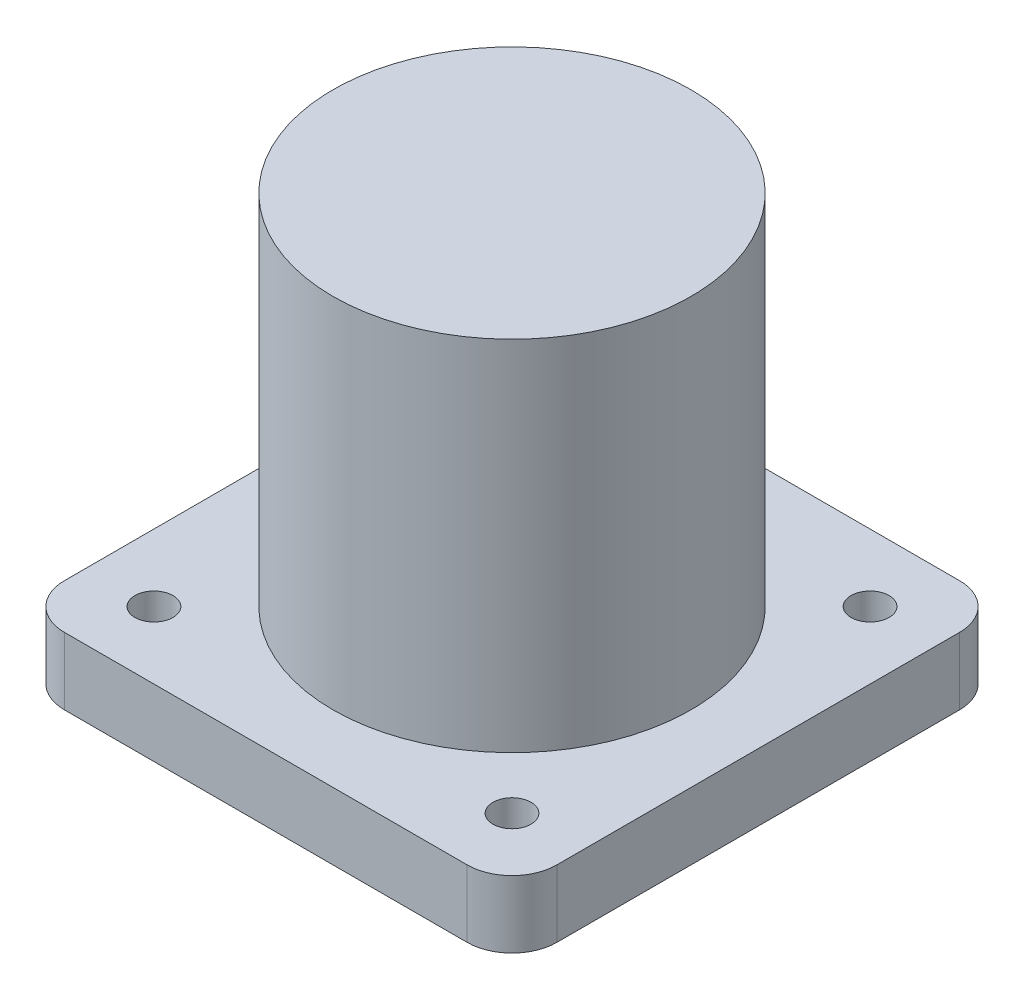
from build123d import *

# Parameters (mm, degrees)
SKETCH1_W           = 110
SKETCH1_H           = 110
BOSS_EXTRUDE1_DEPTH = 15
SKETCH3_R           = 4.25
CUT_EXTRUDE1_DEPTH  = 15
FILLET1_R           = 10
SKETCH4_R           = 40
BOSS_EXTRUDE2_DEPTH = 80


with BuildPart() as part:
    # Sketch1 → Boss-Extrude1 (new body)
    with BuildSketch(Plane(origin=(0, 0, 0), x_dir=(1, 0, 0), z_dir=(0, 1, 0))):
        with Locations((11.233421751, -25.384615385)):
            Rectangle(SKETCH1_W, SKETCH1_H)
    extrude(amount=BOSS_EXTRUDE1_DEPTH)

    # Sketch3 → Cut-Extrude1 (cut)
    with BuildSketch(Plane(origin=(0, 0, 0), x_dir=(-1, 0, 0), z_dir=(0, -1, 0))):
        with Locations(Location((28.766578249, -65.384615385, 0), (0, 0, 90))):
            Circle(SKETCH3_R)
        with Locations(Location((-51.233421751, -65.384615385, 0), (0, 0, 90))):
            Circle(SKETCH3_R)
        with Locations(Location((-51.233421751, 14.615384615, 0), (0, 0, 90))):
            Circle(SKETCH3_R)
        with Locations(Location((28.766578249, 14.615384615, 0), (0, 0, 90))):
            Circle(SKETCH3_R)
    extrude(amount=-CUT_EXTRUDE1_DEPTH, mode=Mode.SUBTRACT)

    # Fillet1
    fillet1_edges = [part.edges().sort_by_distance(p)[0] for p in [
        (-43.766578249, 7.5, -29.615384615),
        (66.233421751, 7.5, -29.615384615),
        (66.233421751, 7.5, 80.384615385),
        (-43.766578249, 7.5, 80.384615385),
    ]]
    fillet(fillet1_edges, radius=FILLET1_R)

    # Sketch4 → Boss-Extrude2 (add)
    with BuildSketch(Plane(origin=(0, 15, 0), x_dir=(1, 0, 0), z_dir=(0, 1, 0))):
        with Locations(Location((11.233421751, -25.384615385, 0), (0, 0, 270))):
            Circle(SKETCH4_R)
    extrude(amount=BOSS_EXTRUDE2_DEPTH)


solid = part.part
